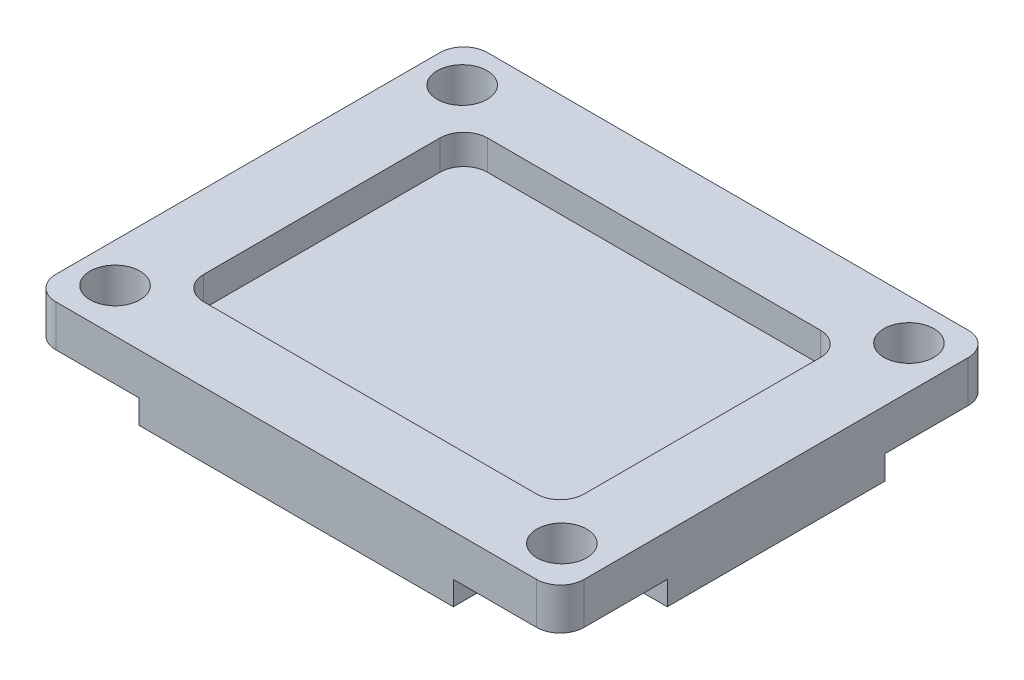
from build123d import *

# Parameters (mm, degrees)
SKETCH_1_W          = 44.45
SKETCH_1_H          = 36.32
EXTRUDE_1_DEPTH     = 5.5
SKETCH_2_R          = 2.1
CUT_EXTRUDE_1_DEPTH = 58.664502946
FILLET_2_R          = 2
CUT_EXTRUDE_START   = -5.5
SKETCH_5_W          = 32.01
SKETCH_5_H          = 23.88
CUT_EXTRUDE_2_DEPTH = 2.5
FILLET_3_R          = 2
SKETCH_6_W          = 9
SKETCH_6_H          = 9
CUT_EXTRUDE_3_DEPTH = 2


with BuildPart() as part:
    # Эскиз1 → Бобышка-Вытянуть1 (new body)
    with BuildSketch(Plane(origin=(0, 0, 0), x_dir=(1, 0, 0), z_dir=(0, 1, 0))):
        with Locations((22.225, 18.16)):
            Rectangle(SKETCH_1_W, SKETCH_1_H)
    extrude(amount=EXTRUDE_1_DEPTH)

    # Эскиз2 → Вырез-Вытянуть1 (cut, through all)
    with BuildSketch(Plane(origin=(0, 5.5, 0), x_dir=(1, 0, 0), z_dir=(0, 1, 0))):
        with Locations(Location((3.302, 32.891, 0), (0, 0, 270))):
            Circle(SKETCH_2_R)
        with Locations(Location((40.894, 32.89, 0), (0, 0, 270))):
            Circle(SKETCH_2_R)
        with Locations(Location((40.894, 3.683, 0), (0, 0, 270))):
            Circle(SKETCH_2_R)
        with Locations(Location((3.302, 3.683, 0), (0, 0, 270))):
            Circle(SKETCH_2_R)
    extrude(amount=-CUT_EXTRUDE_1_DEPTH, mode=Mode.SUBTRACT)

    # Скругление2
    fillet_2_edges = [part.edges().sort_by_distance(p)[0] for p in [
        (0, 2.75, -36.32),
        (44.45, 2.75, -36.32),
        (44.45, 2.75, 0),
        (0, 2.75, 0),
    ]]
    fillet(fillet_2_edges, radius=FILLET_2_R)

    # Эскиз5 → Вырез-Вытянуть2 (cut)
    with BuildSketch(Plane.XZ.offset(CUT_EXTRUDE_START)):
        with Locations((22.225, -18.16)):
            Rectangle(SKETCH_5_W, SKETCH_5_H)
    extrude(amount=CUT_EXTRUDE_2_DEPTH, mode=Mode.SUBTRACT)

    # Скругление3
    fillet_3_edges = [part.edges().sort_by_distance(p)[0] for p in [
        (6.22, 4.25, -30.1),
        (38.23, 4.25, -30.1),
        (38.23, 4.25, -6.22),
        (6.22, 4.25, -6.22),
    ]]
    fillet(fillet_3_edges, radius=FILLET_3_R)

    # Эскиз6 → Вырез-Вытянуть3 (cut)
    with BuildSketch(Plane.XZ):
        with Locations((4.5, -4.5)):
            Rectangle(SKETCH_6_W, SKETCH_6_H)
        with Locations((39.95, -4.5)):
            Rectangle(SKETCH_6_W, SKETCH_6_H)
        with Locations((39.95, -31.82)):
            Rectangle(SKETCH_6_W, SKETCH_6_H)
        with Locations((4.5, -31.82)):
            Rectangle(SKETCH_6_W, SKETCH_6_H)
    extrude(amount=-CUT_EXTRUDE_3_DEPTH, mode=Mode.SUBTRACT)


solid = part.part
